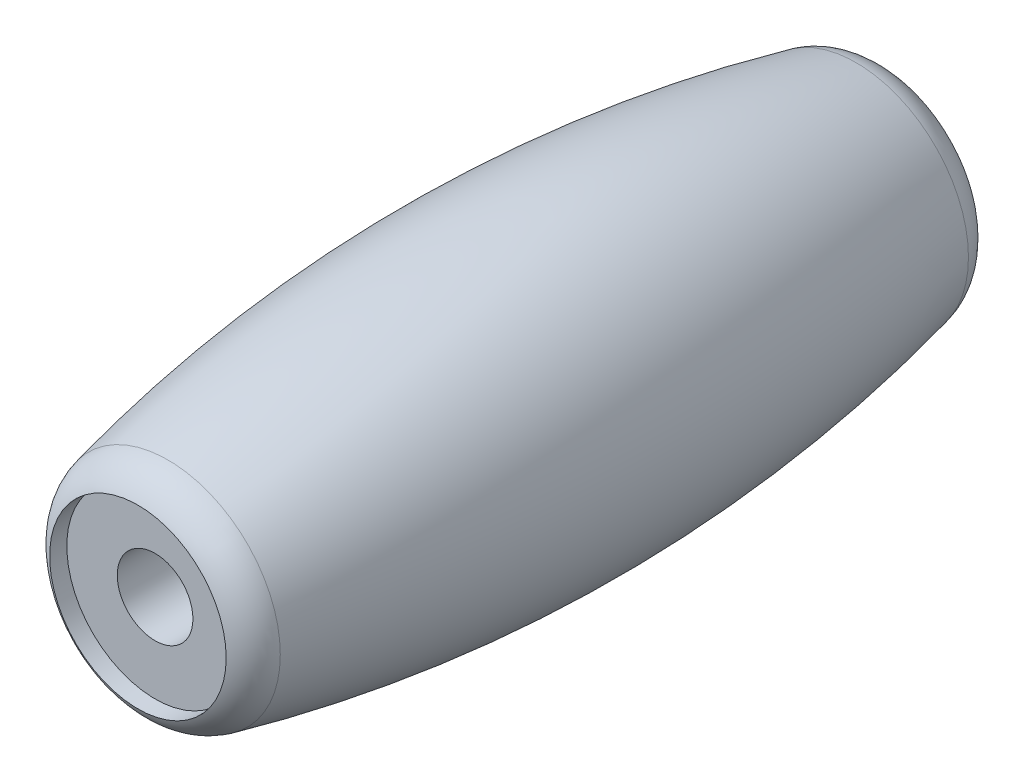
from build123d import *


with BuildPart() as part:
    # Sketch1 → Revolve1 (revolve)
    with BuildSketch(Plane(origin=(0, 0, 0), x_dir=(0, 0, -1), z_dir=(1, 0, 0)), mode=Mode.PRIVATE) as revolve1_sk:
        with BuildLine():
            Line((14.15, 1.5), (-14.15, 1.5))
            Line((-14.15, 1.5), (-14.15, 3.5))
            Line((-14.15, 3.5), (-14.83113883, 3.5))
            ThreePointArc((-14.83113883, 3.5), (-14.345850739, 4.114408721), (-13.641212654, 4.455711775))
            ThreePointArc((-13.641212654, 4.455711775), (0, 6), (13.641212654, 4.455711775))
            ThreePointArc((13.641212654, 4.455711775), (14.345850739, 4.114408721), (14.83113883, 3.5))
            Line((14.83113883, 3.5), (14.15, 3.5))
            Line((14.15, 3.5), (14.15, 1.5))
        make_face()
    revolve(revolve1_sk.sketch.rotate(Axis((0, 0, 15), (0, 0, -1)), 90), axis=Axis((0, 0, 15), (0, 0, -1)))


solid = part.part
